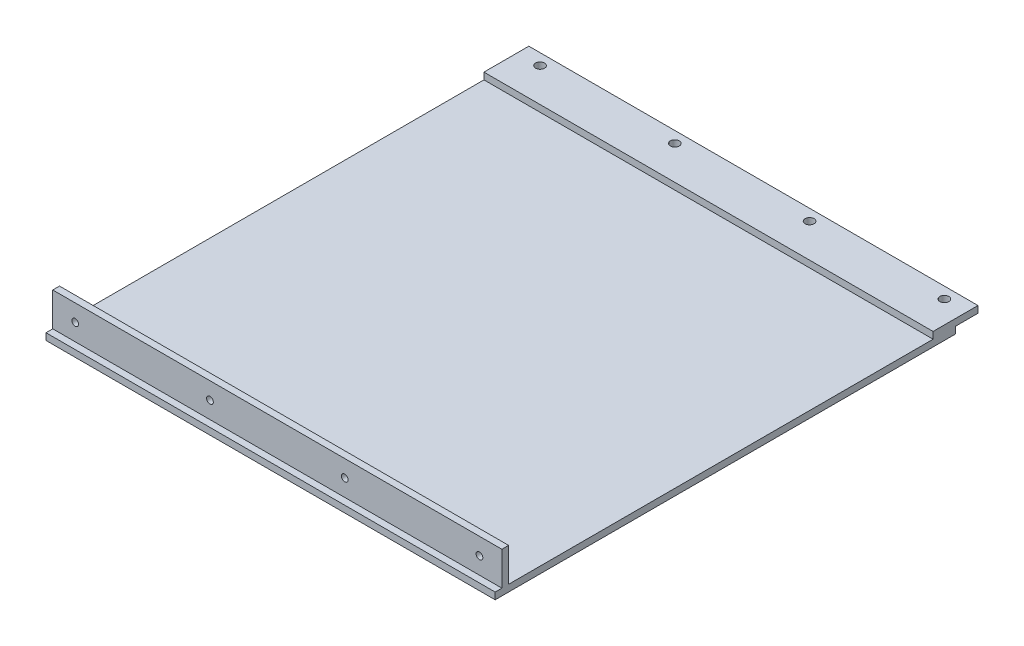
from build123d import *

# Parameters (mm, degrees)
SKETCH1_W           = 200
SKETCH1_H           = 205
BOSS_EXTRUDE1_DEPTH = 3
SKETCH2_W           = 200
SKETCH2_H           = 20
BOSS_EXTRUDE2_DEPTH = 3
CUT_EXTRUDE1_REACH  = 152.639
SKETCH3_R           = 2
LPATTERN1_COUNT     = 4
LPATTERN1_PITCH     = 60
SKETCH4_W           = 200
SKETCH4_H           = 3
BOSS_EXTRUDE3_DEPTH = 15
CUT_EXTRUDE2_REACH  = 237.091
SKETCH5_R           = 1.5
LPATTERN2_COUNT     = 4
LPATTERN2_PITCH     = 60


with BuildPart() as part:
    # Sketch1 → Boss-Extrude1 (new body)
    with BuildSketch(Plane(origin=(0, 0, 0), x_dir=(1, 0, 0), z_dir=(0, 1, 0))):
        Rectangle(SKETCH1_W, SKETCH1_H)
    extrude(amount=BOSS_EXTRUDE1_DEPTH)

    # Sketch2 → Boss-Extrude2 (add)
    with BuildSketch(Plane(origin=(0, 3, 0), x_dir=(1, 0, 0), z_dir=(0, 1, 0))):
        with Locations((0, 102.5)):
            Rectangle(SKETCH2_W, SKETCH2_H)
    extrude(amount=BOSS_EXTRUDE2_DEPTH)

    # Sketch3 → Cut-Extrude1 (cut, up to next)
    with BuildSketch(Plane(origin=(0, 6, 0), x_dir=(1, 0, 0), z_dir=(0, 1, 0)), mode=Mode.PRIVATE) as cut_extrude1_sk1:
        with Locations(Location((-90, 107.5, 0), (0, 0, 270))):
            Circle(SKETCH3_R)
    cut_extrude1_tool1 = extrude(cut_extrude1_sk1.sketch, amount=-CUT_EXTRUDE1_REACH, mode=Mode.PRIVATE) & part.part
    cut_extrude1 = cut_extrude1_tool1.solids().sort_by_distance((-90, 6, -107.5))[0]
    add(cut_extrude1, mode=Mode.SUBTRACT)

    # LPattern1: Cut-Extrude1 ×4
    with Locations(*[(i * LPATTERN1_PITCH, 0, 0) for i in range(1, LPATTERN1_COUNT)]):
        add(cut_extrude1, mode=Mode.SUBTRACT)

    # Sketch4 → Boss-Extrude3 (add)
    with BuildSketch(Plane(origin=(0, 3, 0), x_dir=(1, 0, 0), z_dir=(0, 1, 0))):
        with Locations((0, -98)):
            Rectangle(SKETCH4_W, SKETCH4_H)
    extrude(amount=BOSS_EXTRUDE3_DEPTH)

    # Sketch5 → Cut-Extrude2 (cut, up to next)
    with BuildSketch(Plane.XY.offset(99.5), mode=Mode.PRIVATE) as cut_extrude2_sk1:
        with Locations((-90, 10.5)):
            Circle(SKETCH5_R)
    cut_extrude2_tool1 = extrude(cut_extrude2_sk1.sketch, amount=-CUT_EXTRUDE2_REACH, mode=Mode.PRIVATE) & part.part
    cut_extrude2 = cut_extrude2_tool1.solids().sort_by_distance((-90, 10.5, 99.5))[0]
    add(cut_extrude2, mode=Mode.SUBTRACT)

    # LPattern2: Cut-Extrude2 ×4
    with Locations(*[(i * LPATTERN2_PITCH, 0, 0) for i in range(1, LPATTERN2_COUNT)]):
        add(cut_extrude2, mode=Mode.SUBTRACT)


solid = part.part
